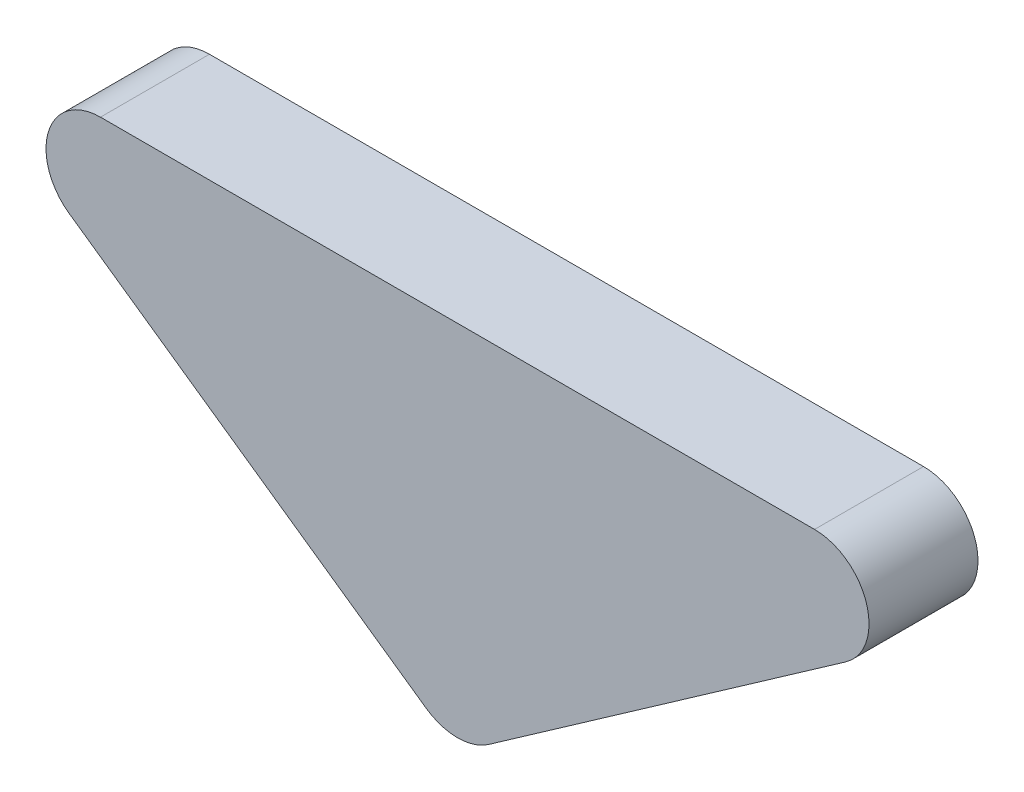
from build123d import *

# Parameters (mm, degrees)
EXTRUDE_1_DEPTH = 10


with BuildPart() as part:
    # 草图1 → 凸台-拉伸1 (new body)
    with BuildSketch(Plane.XY):
        with BuildLine():
            Line((2.867882182, -4.095760221), (35.633963953, 18.847297233))
            ThreePointArc((35.633963953, 18.847297233), (37.534666525, 24.446586452), (32.766081772, 27.943057454))
            Line((32.766081772, 27.943057454), (-32.766081772, 27.943057454))
            ThreePointArc((-32.766081772, 27.943057454), (-37.534666525, 24.446586452), (-35.633963953, 18.847297233))
            Line((-35.633963953, 18.847297233), (-2.867882182, -4.095760221))
            ThreePointArc((-2.867882182, -4.095760221), (0, -5), (2.867882182, -4.095760221))
        make_face()
    extrude(amount=EXTRUDE_1_DEPTH)


solid = part.part
